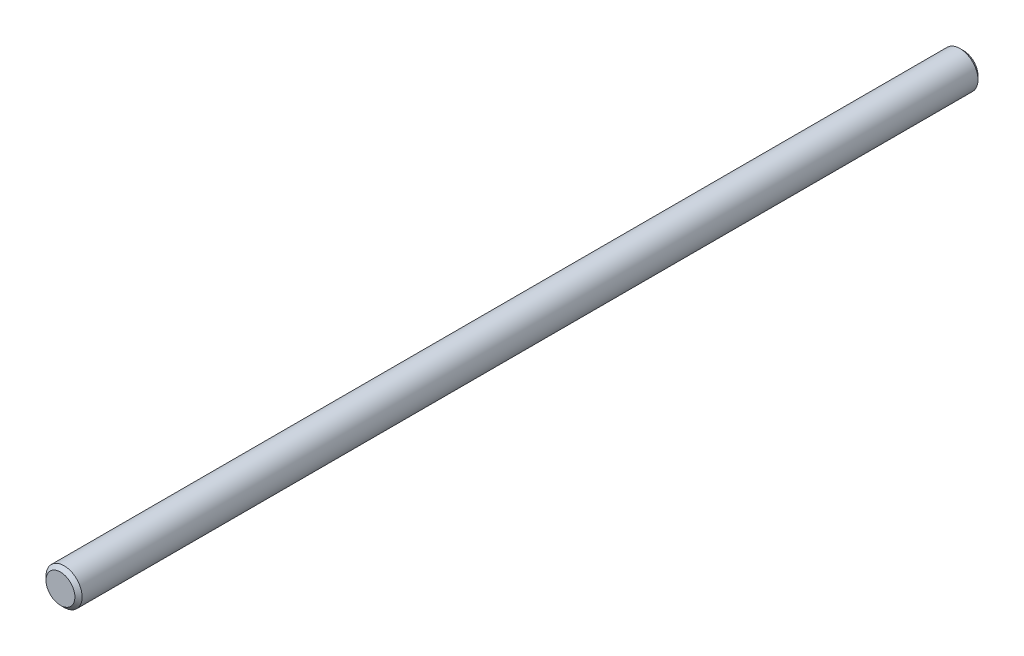
from build123d import *

# Parameters (mm, degrees)
SKETCH1_R      = 4
EXTRUDE1_DEPTH = 100
CHAMFER1_SIZE  = 0.8


with BuildPart() as part:
    # Sketch1 → Extrude1 (new, symmetric)
    with BuildSketch(Plane.XY):
        Circle(SKETCH1_R)
    extrude(amount=EXTRUDE1_DEPTH, both=True)

    # Chamfer1
    chamfer1_edges = [part.edges().sort_by_distance(p)[0] for p in [
        (-4, 0, -100),
        (-4, 0, 100),
    ]]
    chamfer(chamfer1_edges, length=CHAMFER1_SIZE)


solid = part.part
